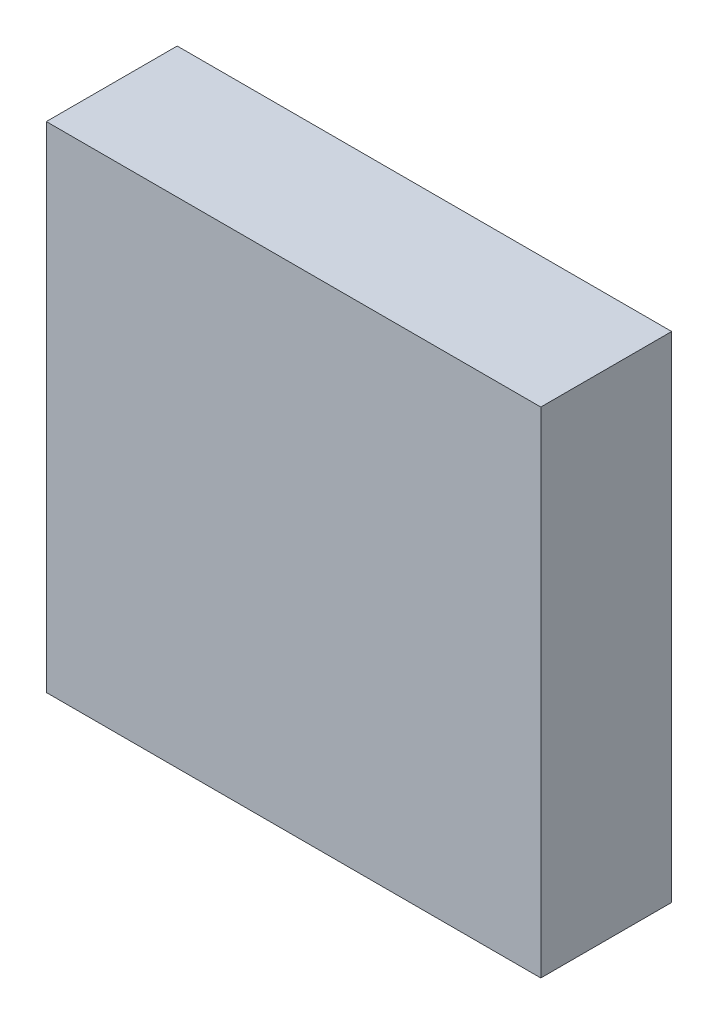
from build123d import *

# Parameters (mm, degrees)
SKETCH1_W           = 15
SKETCH1_H           = 15
BOSS_EXTRUDE1_DEPTH = 3.97


with BuildPart() as part:
    # Sketch1 → Boss-Extrude1 (new body)
    with BuildSketch(Plane.XY):
        Rectangle(SKETCH1_W, SKETCH1_H)
    extrude(amount=BOSS_EXTRUDE1_DEPTH)


solid = part.part
